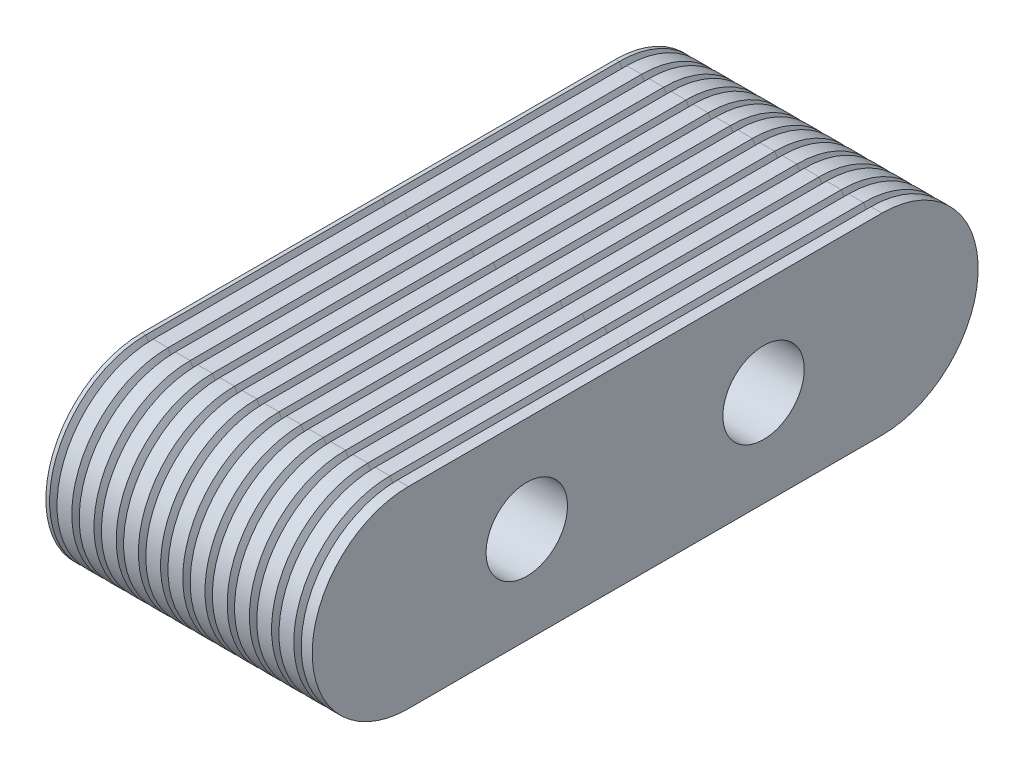
from build123d import *

# Parameters (mm, degrees)
BOSS_EXTRUDE1_DEPTH     = 9
LPATTERN1_COUNT         = 12
LPATTERN1_PITCH         = 1.5
CUT_EXTRUDE1_DEPTH      = 30.538110975
CUT_EXTRUDE1_DEPTH_BACK = 30.538110975
SKETCH5_R               = 2.75


with BuildPart() as part:
    # Sketch2 → Boss-Extrude1 (new, symmetric)
    with BuildSketch(Plane(origin=(0, 0, 0), x_dir=(0, 0, -1), z_dir=(1, 0, 0))):
        with BuildLine():
            Line((16, -6.5), (-16, -6.5))
            ThreePointArc((-16, -6.5), (-22.5, 0), (-16, 6.5))
            Line((-16, 6.5), (16, 6.5))
            ThreePointArc((16, 6.5), (22.5, 0), (16, -6.5))
        make_face()
    extrude(amount=BOSS_EXTRUDE1_DEPTH, both=True)

    # Cut-Sweep1: sweep along a path in Sketch4
    with BuildLine(Plane.ZY.offset(9)) as cut_sweep1_path:
        Line((-16, -6.5), (16, -6.5))
        ThreePointArc((16, -6.5), (22.5, 0), (16, 6.5))
        Line((16, 6.5), (-16, 6.5))
        ThreePointArc((-16, 6.5), (-22.5, 0), (-16, -6.5))
    # Sketch3 → Cut-Sweep1 (sweep, cut)
    with BuildSketch(Plane.XY):
        Polygon((-8.747493318, 6.5), (-8.497493318, 6.066987298), (-8.247493318, 6.5), align=None)
    cut_sweep1 = sweep(path=cut_sweep1_path.line, mode=Mode.SUBTRACT)

    # LPattern1: Cut-Sweep1 ×12
    with Locations(*[(i * LPATTERN1_PITCH, 0, 0) for i in range(1, LPATTERN1_COUNT)]):
        add(cut_sweep1, mode=Mode.SUBTRACT)

    # Sketch5 → Cut-Extrude1 (cut, two sides: drawn at the far end of the back side and taken through both)
    with BuildSketch(Plane(origin=(9, 0, 0), x_dir=(0, 0, -1), z_dir=(1, 0, 0)).offset(-CUT_EXTRUDE1_DEPTH_BACK)):
        with Locations((-8, 0)):
            Circle(SKETCH5_R)
        with Locations((8, 0)):
            Circle(SKETCH5_R)
    extrude(amount=CUT_EXTRUDE1_DEPTH + CUT_EXTRUDE1_DEPTH_BACK, mode=Mode.SUBTRACT)


solid = part.part
